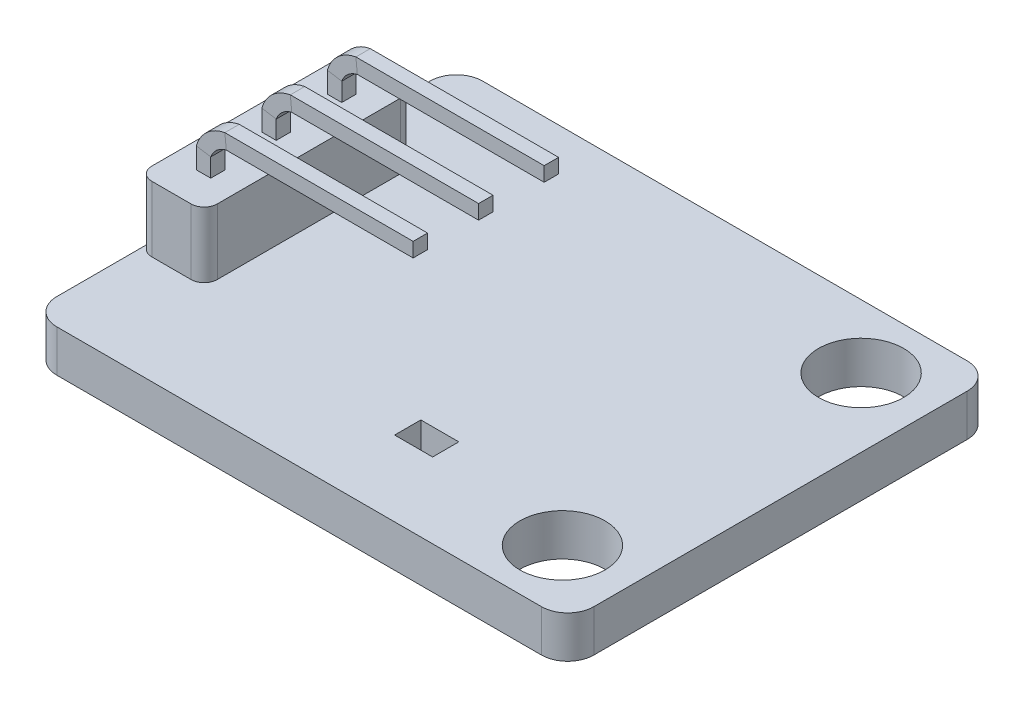
from build123d import *

# Parameters (mm, degrees)
SKETCH1_W           = 20.5
SKETCH1_H           = 16.25
SKETCH1_R           = 1.625
BOSS_EXTRUDE1_DEPTH = 1.6
FILLET1_R           = 1
SKETCH2_W           = 2.5
SKETCH2_H           = 8
BOSS_EXTRUDE2_DEPTH = 2.5
FILLET2_R           = 0.5
SKETCH8_W           = 0.55
SKETCH8_H           = 0.55
SKETCH9_W           = 0.55
SKETCH9_H           = 0.55
SKETCH12_W          = 0.55
SKETCH12_H          = 0.55
SKETCH13_W          = 1.45
SKETCH13_H          = 1
CUT_EXTRUDE1_DEPTH  = 4


with BuildPart() as part:
    # Sketch1 → Boss-Extrude1 (new body)
    with BuildSketch(Plane(origin=(0, 0, 0), x_dir=(1, 0, 0), z_dir=(0, 1, 0))):
        Rectangle(SKETCH1_W, SKETCH1_H)
        with Locations(Location((7.625, 5.7, 0), (0, 0, 270))):
            Circle(SKETCH1_R, mode=Mode.SUBTRACT)
        with Locations(Location((7.625, -5.7, 0), (0, 0, 90))):
            Circle(SKETCH1_R, mode=Mode.SUBTRACT)
    extrude(amount=BOSS_EXTRUDE1_DEPTH)

    # Fillet1
    fillet1_edges = [part.edges().sort_by_distance(p)[0] for p in [
        (10.25, 0.8, 8.125),
        (-10.25, 0.8, 8.125),
        (-10.25, 0.8, -8.125),
        (10.25, 0.8, -8.125),
    ]]
    fillet(fillet1_edges, radius=FILLET1_R)

    # Sketch2 → Boss-Extrude2 (add)
    with BuildSketch(Plane(origin=(0, 1.6, 0), x_dir=(1, 0, 0), z_dir=(0, 1, 0))):
        with Locations((-9, 0)):
            Rectangle(SKETCH2_W, SKETCH2_H)
    extrude(amount=BOSS_EXTRUDE2_DEPTH)

    # Fillet2
    fillet2_edges = [part.edges().sort_by_distance(p)[0] for p in [
        (-7.75, 2.85, 4),
        (-7.75, 2.85, -4),
        (-10.25, 2.85, -4),
        (-10.25, 2.85, 4),
    ]]
    fillet(fillet2_edges, radius=FILLET2_R)

    # Sweep2: sweep along a path in Sketch5
    with BuildLine(Plane.XY.offset(-2.5)) as sweep2_path:
        Line((-9, 4.1), (-9, 4.85))
        ThreePointArc((-9, 4.85), (-8.682958383, 5.34027213), (-8.160059174, 5.6))
        Line((-8.160059174, 5.6), (-1, 5.6))
    # Sketch8 → Sweep2 (sweep)
    with BuildSketch(Plane(origin=(0, 4.1, 0), x_dir=(1, 0, 0), z_dir=(0, 1, 0))):
        with Locations((-9.001105099, 2.502876889)):
            Rectangle(SKETCH8_W, SKETCH8_H)
    sweep(path=sweep2_path.line, transition=Transition.RIGHT)

    # Sweep3: sweep along a path in Sketch6
    with BuildLine(Plane.XY.offset(2.5)) as sweep3_path:
        Line((-9, 4.1), (-9, 4.85))
        ThreePointArc((-9, 4.85), (-8.682958383, 5.34027213), (-8.160059174, 5.6))
        Line((-8.160059174, 5.6), (-1, 5.6))
    # Sketch9 → Sweep3 (sweep)
    with BuildSketch(Plane(origin=(0, 4.1, 0), x_dir=(1, 0, 0), z_dir=(0, 1, 0))):
        with Locations((-8.999962547, -2.498553748)):
            Rectangle(SKETCH9_W, SKETCH9_H)
    sweep(path=sweep3_path.line, transition=Transition.RIGHT)

    # Sweep4: sweep along a path in Sketch11
    with BuildLine(Plane.XY) as sweep4_path:
        Line((-9, 4.1), (-9, 4.85))
        ThreePointArc((-9, 4.85), (-8.682958383, 5.34027213), (-8.160059174, 5.6))
        Line((-8.160059174, 5.6), (-1, 5.6))
    # Sketch12 → Sweep4 (sweep)
    with BuildSketch(Plane(origin=(0, 4.1, 0), x_dir=(1, 0, 0), z_dir=(0, 1, 0))):
        with Locations((-9, 0)):
            Rectangle(SKETCH12_W, SKETCH12_H)
    sweep(path=sweep4_path.line, transition=Transition.RIGHT)

    # Sketch13 → Cut-Extrude1 (cut)
    with BuildSketch(Plane.XZ):
        with Locations((1.5, 4.755)):
            Rectangle(SKETCH13_W, SKETCH13_H)
    extrude(amount=-CUT_EXTRUDE1_DEPTH, mode=Mode.SUBTRACT)


solid = part.part
